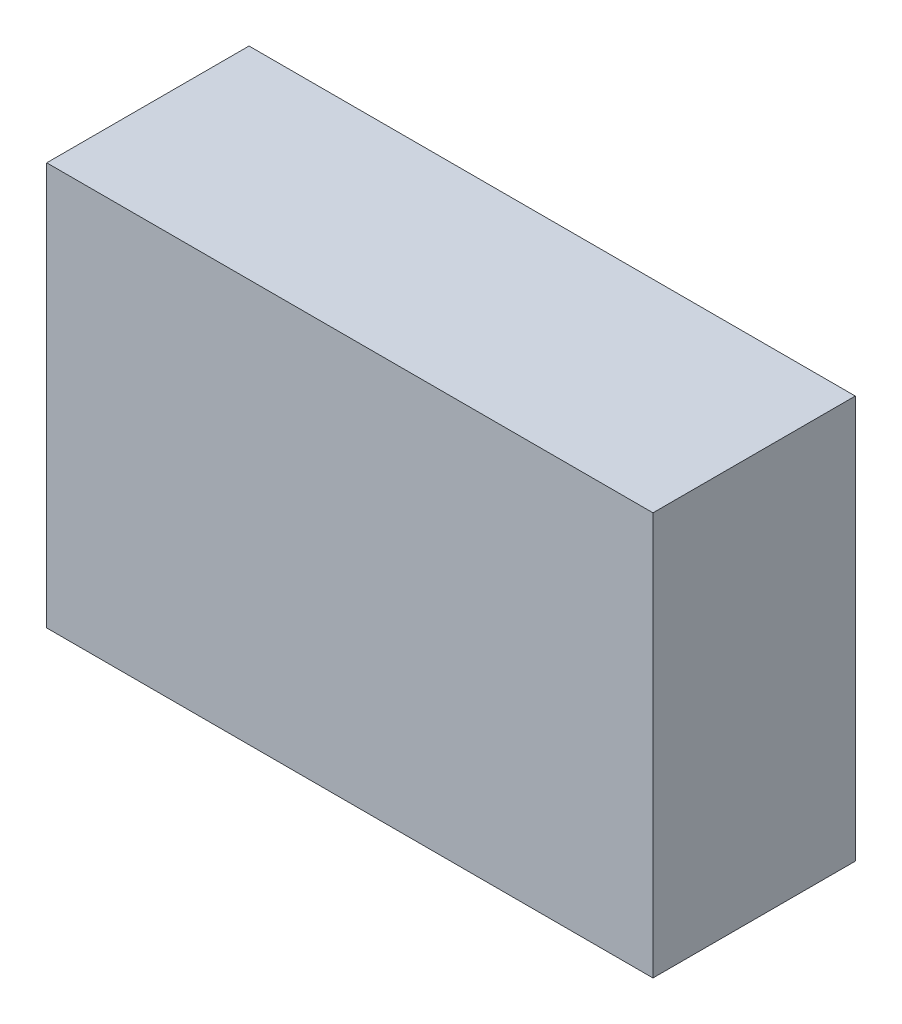
from build123d import *

# Parameters (mm, degrees)
SKETCH1_W               = 2.9968
SKETCH1_H               = 1.9914
COMPONENT_OUTLINE_DEPTH = 1


with BuildPart() as part:
    # Sketch1 → Component_Outline (new body)
    with BuildSketch(Plane.XY):
        with Locations((0, 0.0127)):
            Rectangle(SKETCH1_W, SKETCH1_H)
    extrude(amount=COMPONENT_OUTLINE_DEPTH)


solid = part.part
